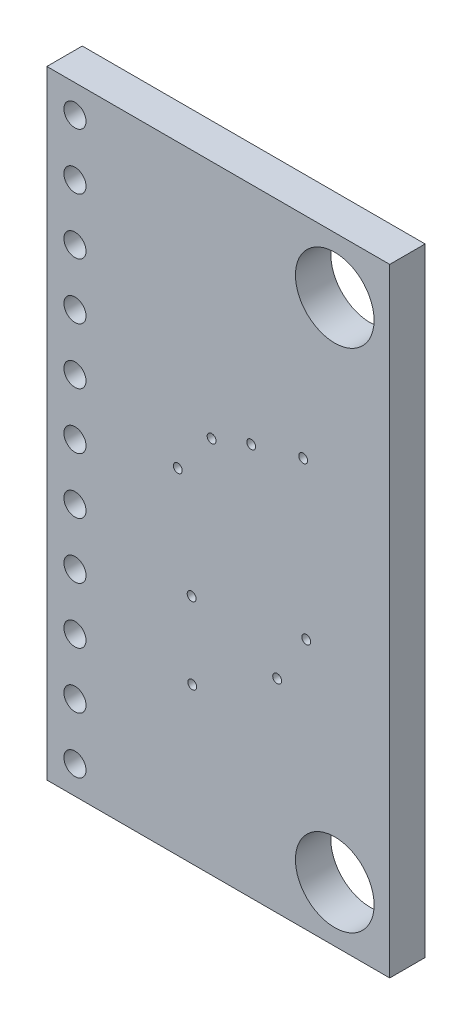
from build123d import *

# Parameters (mm, degrees)
SKETCH1_W           = 15.5
SKETCH1_H           = 27.94
BOSS_EXTRUDE1_DEPTH = 1.6
SKETCH2_R           = 0.5
SKETCH2_R_2         = 1.778
CUT_EXTRUDE1_DEPTH  = 2
SKETCH3_R           = 0.2
CUT_EXTRUDE2_DEPTH  = 10


with BuildPart() as part:
    # Sketch1 → Boss-Extrude1 (new body)
    with BuildSketch(Plane.XY):
        Rectangle(SKETCH1_W, SKETCH1_H)
    extrude(amount=BOSS_EXTRUDE1_DEPTH)

    # Sketch2 → Cut-Extrude1 (cut)
    with BuildSketch(Plane.XY.offset(1.6)):
        with Locations((-6.48, -12.7)):
            Circle(SKETCH2_R)
        with Locations((-6.48, -10.16)):
            Circle(SKETCH2_R)
        with Locations((-6.48, -7.62)):
            Circle(SKETCH2_R)
        with Locations((-6.48, -5.08)):
            Circle(SKETCH2_R)
        with Locations((-6.48, -2.54)):
            Circle(SKETCH2_R)
        with Locations((-6.48, 0)):
            Circle(SKETCH2_R)
        with Locations((-6.48, 2.54)):
            Circle(SKETCH2_R)
        with Locations((-6.48, 5.08)):
            Circle(SKETCH2_R)
        with Locations((-6.48, 7.62)):
            Circle(SKETCH2_R)
        with Locations((-6.48, 10.16)):
            Circle(SKETCH2_R)
        with Locations((-6.48, 12.7)):
            Circle(SKETCH2_R)
        with Locations((5.26414257, 11.423545933)):
            Circle(SKETCH2_R_2)
        with Locations((5.26414257, -11.464062499)):
            Circle(SKETCH2_R_2)
    extrude(amount=-CUT_EXTRUDE1_DEPTH, mode=Mode.SUBTRACT)

    # Sketch3 → Cut-Extrude2 (cut)
    with BuildSketch(Plane.XY.offset(1.6)):
        with Locations((-1.830670849, 1.202487627)):
            Circle(SKETCH3_R)
        with Locations((-0.302406534, 3.125566843)):
            Circle(SKETCH3_R)
        with Locations((1.486755487, 3.791476374)):
            Circle(SKETCH3_R)
        with Locations((3.836977644, 4.423555572)):
            Circle(SKETCH3_R)
        with Locations((3.975659184, -2.601471813)):
            Circle(SKETCH3_R)
        with Locations((2.659050244, -4.790940134)):
            Circle(SKETCH3_R)
        with Locations((-1.177453811, -6.944947611)):
            Circle(SKETCH3_R)
        with Locations((-1.205838194, -3.50049205)):
            Circle(SKETCH3_R)
    extrude(amount=-CUT_EXTRUDE2_DEPTH, mode=Mode.SUBTRACT)


solid = part.part
